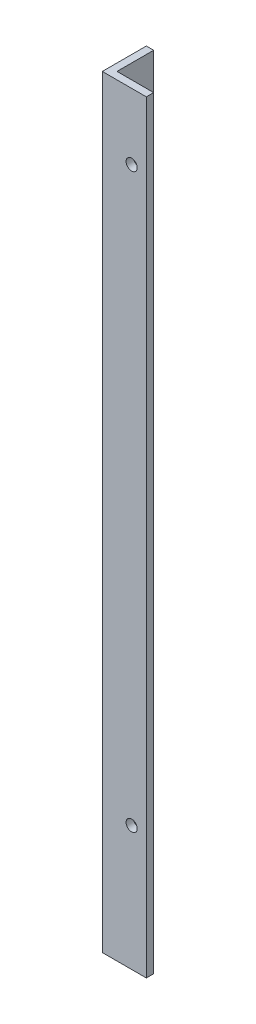
from build123d import *

# Parameters (mm, degrees)
BOSS_EXTRUDE1_DEPTH = 330.2
CUT_EXTRUDE1_REACH  = 333.13
SKETCH2_R           = 2.413


with BuildPart() as part:
    # Sketch1 → Boss-Extrude1 (new body)
    with BuildSketch(Plane(origin=(0, 0, 0), x_dir=(1, 0, 0), z_dir=(0, 1, 0))):
        Polygon((3.175, 3.175), (3.175, 19.05), (0, 19.05), (0, 0), (19.05, 0), (19.05, 3.175), align=None)
    extrude(amount=BOSS_EXTRUDE1_DEPTH)

    # Sketch2 → Cut-Extrude1 (cut, up to next)
    with BuildSketch(Plane(origin=(0, 0, -3.175), x_dir=(-1, 0, 0), z_dir=(0, 0, -1)), mode=Mode.PRIVATE) as cut_extrude1_sk1:
        with Locations((-12.7, 53.975)):
            Circle(SKETCH2_R)
    cut_extrude1_tool1 = extrude(cut_extrude1_sk1.sketch, amount=-CUT_EXTRUDE1_REACH, mode=Mode.PRIVATE) & part.part
    # Sketch2 → Cut-Extrude1 (cut, up to next)
    with BuildSketch(Plane(origin=(0, 0, -3.175), x_dir=(-1, 0, 0), z_dir=(0, 0, -1)), mode=Mode.PRIVATE) as cut_extrude1_sk2:
        with Locations((-12.7, 301.625)):
            Circle(SKETCH2_R)
    cut_extrude1_tool2 = extrude(cut_extrude1_sk2.sketch, amount=-CUT_EXTRUDE1_REACH, mode=Mode.PRIVATE) & part.part
    add(cut_extrude1_tool1.solids().sort_by_distance((12.7, 53.975, -3.175))[0], mode=Mode.SUBTRACT)
    add(cut_extrude1_tool2.solids().sort_by_distance((12.7, 301.625, -3.175))[0], mode=Mode.SUBTRACT)


solid = part.part
